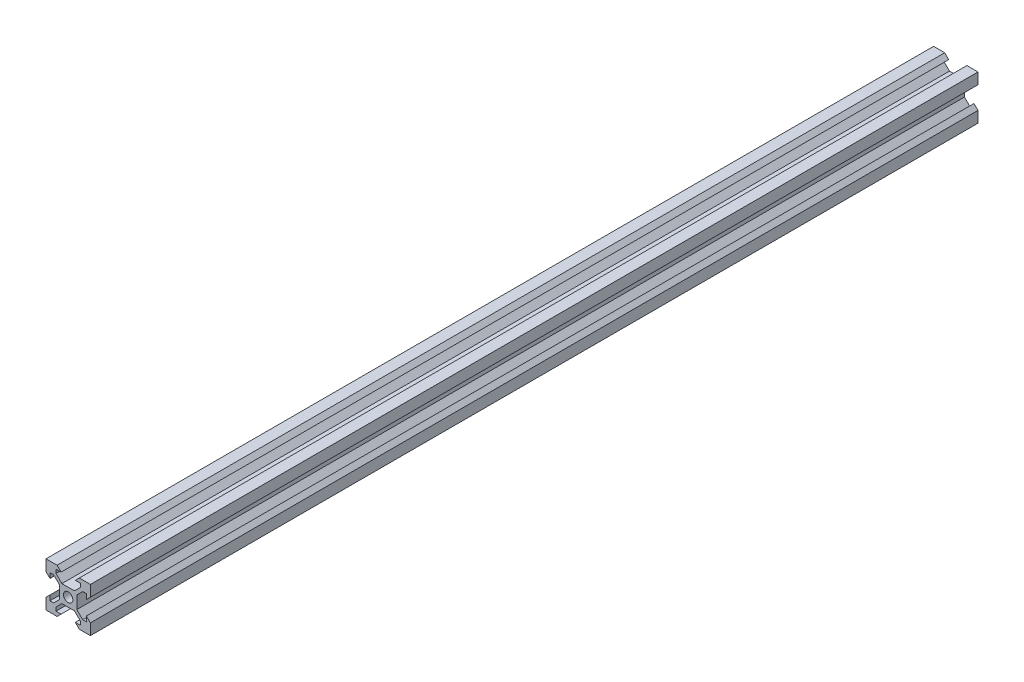
from build123d import *

# Parameters (mm, degrees)
SKETCH1_R           = 2.1
BOSS_EXTRUDE1_DEPTH = 400


with BuildPart() as part:
    # Sketch1 → Boss-Extrude1 (new body)
    with BuildSketch(Plane.XY):
        Polygon((-10, 10), (-10, 5), (-8.2, 3.2), (-8.2, 5.499339828), (-6.56, 5.499339828), (-3.900660172, 2.84), (-3.900660172, -2.84), (-6.56, -5.499339828), (-8.2, -5.499339828), (-8.2, -3.2), (-10, -5), (-10, -10), (-5, -10), (-3.2, -8.2), (-5.499339828, -8.2), (-5.499339828, -6.56), (-2.84, -3.900660172), (2.84, -3.900660172), (5.499339828, -6.56), (5.499339828, -8.2), (3.2, -8.2), (5, -10), (10, -10), (10, -5), (8.2, -3.2), (8.2, -5.499339828), (6.56, -5.499339828), (3.900660172, -2.84), (3.900660172, 2.84), (6.56, 5.499339828), (8.2, 5.499339828), (8.2, 3.2), (10, 5), (10, 10), (5, 10), (3.2, 8.2), (5.499339828, 8.2), (5.499339828, 6.56), (2.84, 3.900660172), (-2.84, 3.900660172), (-5.499339828, 6.56), (-5.499339828, 8.2), (-3.2, 8.2), (-5, 10), align=None)
        Circle(SKETCH1_R, mode=Mode.SUBTRACT)
    extrude(amount=-BOSS_EXTRUDE1_DEPTH)


solid = part.part
